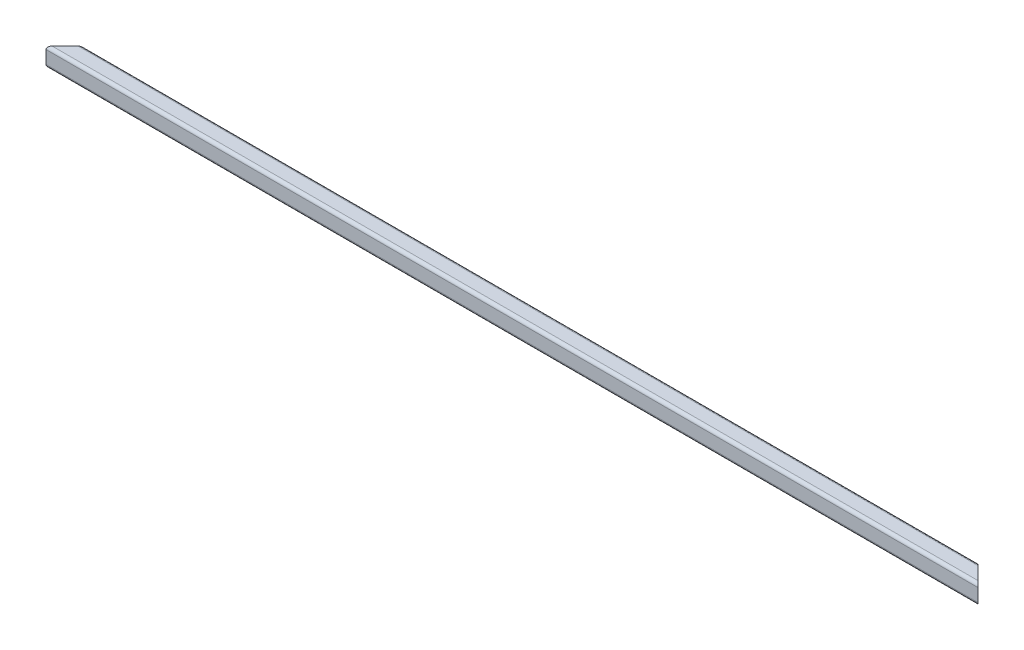
from build123d import *

# Parameters (mm, degrees)
TUBE_SQUARE_40_X_40_X_3_2_5_DEPTH = 1960
CUT_EXTRUDE1_DEPTH                = 1961.510137694
SKETCH15_R                        = 2
CUT_EXTRUDE3_DEPTH                = 1961.204071009


with BuildPart() as part:
    # Sketch12 → Tube (square) 40 X 40 X 3.2(5) (new body)
    with BuildSketch(Plane(origin=(0, 0, 0), x_dir=(0, 0, -1), z_dir=(1, 0, 0))):
        with BuildLine():
            Line((-13.6, -20), (13.6, -20))
            ThreePointArc((13.6, -20), (18.1254834, -18.1254834), (20, -13.6))
            Line((20, -13.6), (20, 13.6))
            ThreePointArc((20, 13.6), (18.1254834, 18.1254834), (13.6, 20))
            Line((13.6, 20), (-13.6, 20))
            ThreePointArc((-13.6, 20), (-18.1254834, 18.1254834), (-20, 13.6))
            Line((-20, 13.6), (-20, -13.6))
            ThreePointArc((-20, -13.6), (-18.1254834, -18.1254834), (-13.6, -20))
        make_face()
        with BuildLine():
            Line((-13.6, -16.8), (13.6, -16.8))
            ThreePointArc((13.6, -16.8), (15.8627417, -15.8627417), (16.8, -13.6))
            Line((16.8, -13.6), (16.8, 13.6))
            ThreePointArc((16.8, 13.6), (15.8627417, 15.8627417), (13.6, 16.8))
            Line((13.6, 16.8), (-13.6, 16.8))
            ThreePointArc((-13.6, 16.8), (-15.8627417, 15.8627417), (-16.8, 13.6))
            Line((-16.8, 13.6), (-16.8, -13.6))
            ThreePointArc((-16.8, -13.6), (-15.8627417, -15.8627417), (-13.6, -16.8))
        make_face(mode=Mode.SUBTRACT)
    extrude(amount=TUBE_SQUARE_40_X_40_X_3_2_5_DEPTH)

    # Sketch13 → Cut-Extrude1 (cut, through all)
    with BuildSketch(Plane(origin=(0, 20, 0), x_dir=(1, 0, 0), z_dir=(0, 1, 0))):
        Polygon((1960, 20), (1960, -20), (1920, 20), align=None)
        Polygon((0, 20), (0, -20), (40, 20), align=None)
    extrude(amount=-CUT_EXTRUDE1_DEPTH, mode=Mode.SUBTRACT)

    # Sketch15 → Cut-Extrude3 (cut, through all)
    with BuildSketch(Plane(origin=(0, 0, 0), x_dir=(1, 0, 0), z_dir=(0, 1, 0))):
        with Locations(Location((980, 0, 0), (0, 0, 270))):
            Circle(SKETCH15_R)
        with Locations((20, 0)):
            Circle(SKETCH15_R)
        with Locations((1940, 0)):
            Circle(SKETCH15_R)
        with Locations(Location((500, 0, 0), (0, 0, 270))):
            Circle(SKETCH15_R)
        with Locations(Location((1460, 0, 0), (0, 0, 270))):
            Circle(SKETCH15_R)
    extrude(amount=-CUT_EXTRUDE3_DEPTH, mode=Mode.SUBTRACT)


solid = part.part
